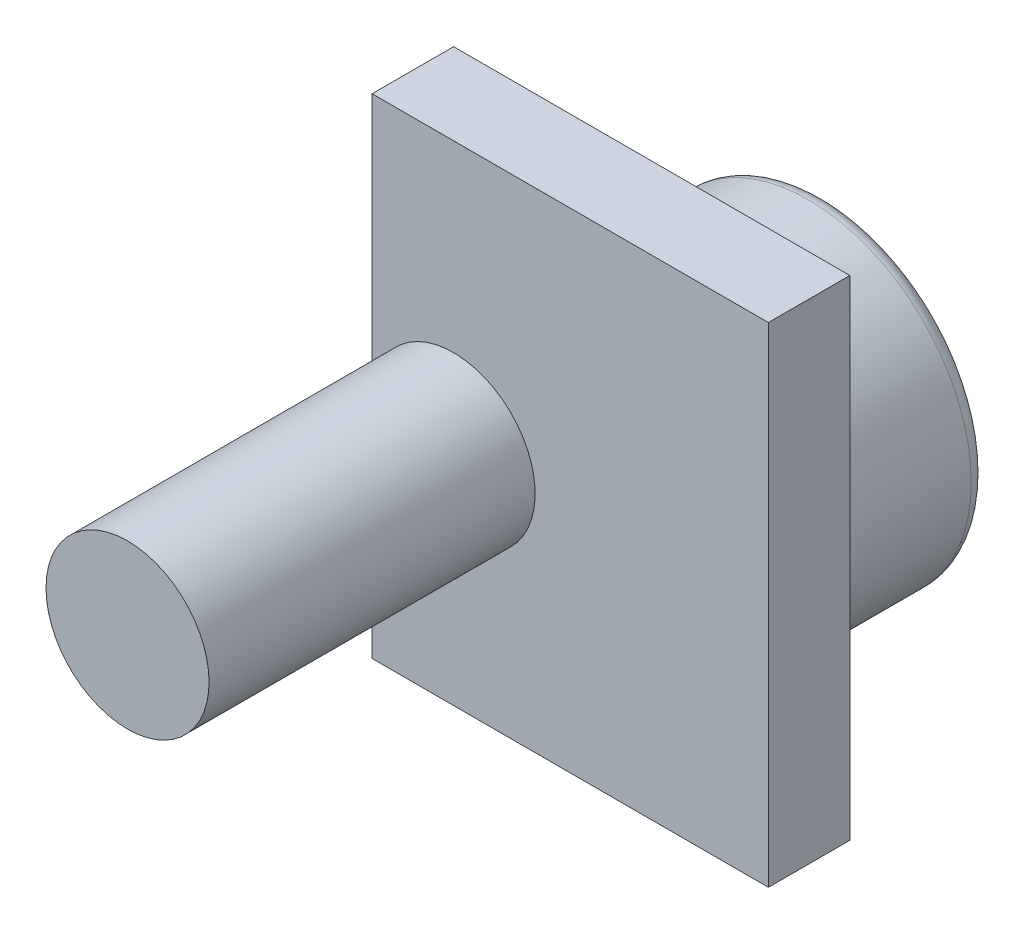
from build123d import *

# Parameters (mm, degrees)
SKIZZE2_R                       = 4
AUFSATZ_LINEAR_AUSTRAGEN1_DEPTH = 4
SKIZZE3_W                       = 9.723167254
SKIZZE3_H                       = 12
AUFSATZ_LINEAR_AUSTRAGEN2_DEPTH = 2
VERRUNDUNG1_R                   = 0.4
SKIZZE5_R                       = 2
AUFSATZ_LINEAR_AUSTRAGEN4_DEPTH = 8
SCHNITT_LINEAR_AUSTRAGEN1_DEPTH = 0.4
AUFSATZ_LINEAR_AUSTRAGEN5_DEPTH = 0.4


with BuildPart() as part:
    # Skizze2 → Aufsatz-Linear austragen1 (new body)
    with BuildSketch(Plane.XY):
        with Locations((-80.86767695, 4.567589342)):
            Circle(SKIZZE2_R)
    extrude(amount=-AUFSATZ_LINEAR_AUSTRAGEN1_DEPTH)

    # Skizze3 → Aufsatz-Linear austragen2 (add)
    with BuildSketch(Plane.XY):
        with Locations((-81.106093323, 5.067589342)):
            Rectangle(SKIZZE3_W, SKIZZE3_H)
    extrude(amount=AUFSATZ_LINEAR_AUSTRAGEN2_DEPTH)

    # Verrundung1
    verrundung1_edges = [part.edges().sort_by_distance(p)[0] for p in [
        (-84.86767695, 4.567589342, -4),
    ]]
    fillet(verrundung1_edges, radius=VERRUNDUNG1_R)

    # Skizze5 → Aufsatz-Linear austragen4 (add)
    with BuildSketch(Plane.XY.offset(2)):
        with Locations((-83.96767695, 4.567589342)):
            Circle(SKIZZE5_R)
    extrude(amount=AUFSATZ_LINEAR_AUSTRAGEN4_DEPTH)

    # Skizze4 → Schnitt-Linear austragen1 (cut)
    with BuildSketch(Plane(origin=(0, 0, -4), x_dir=(-1, 0, 0), z_dir=(0, 0, -1))):
        Polygon((78.36767695, 3.037462323), (83.36767695, 3.037462323), (80.86767695, 7.367589342), align=None)
    extrude(amount=-SCHNITT_LINEAR_AUSTRAGEN1_DEPTH, mode=Mode.SUBTRACT)


with BuildPart() as body_2:
    # Skizze4<3> → Aufsatz-Linear austragen5 (new body)
    with BuildSketch(Plane(origin=(0, 0, -4), x_dir=(-1, 0, 0), z_dir=(0, 0, -1))):
        Polygon((78.36767695, 3.037462323), (83.36767695, 3.037462323), (80.86767695, 7.367589342), align=None)
    extrude(amount=-AUFSATZ_LINEAR_AUSTRAGEN5_DEPTH)


solid = Compound([part.part, body_2.part])
